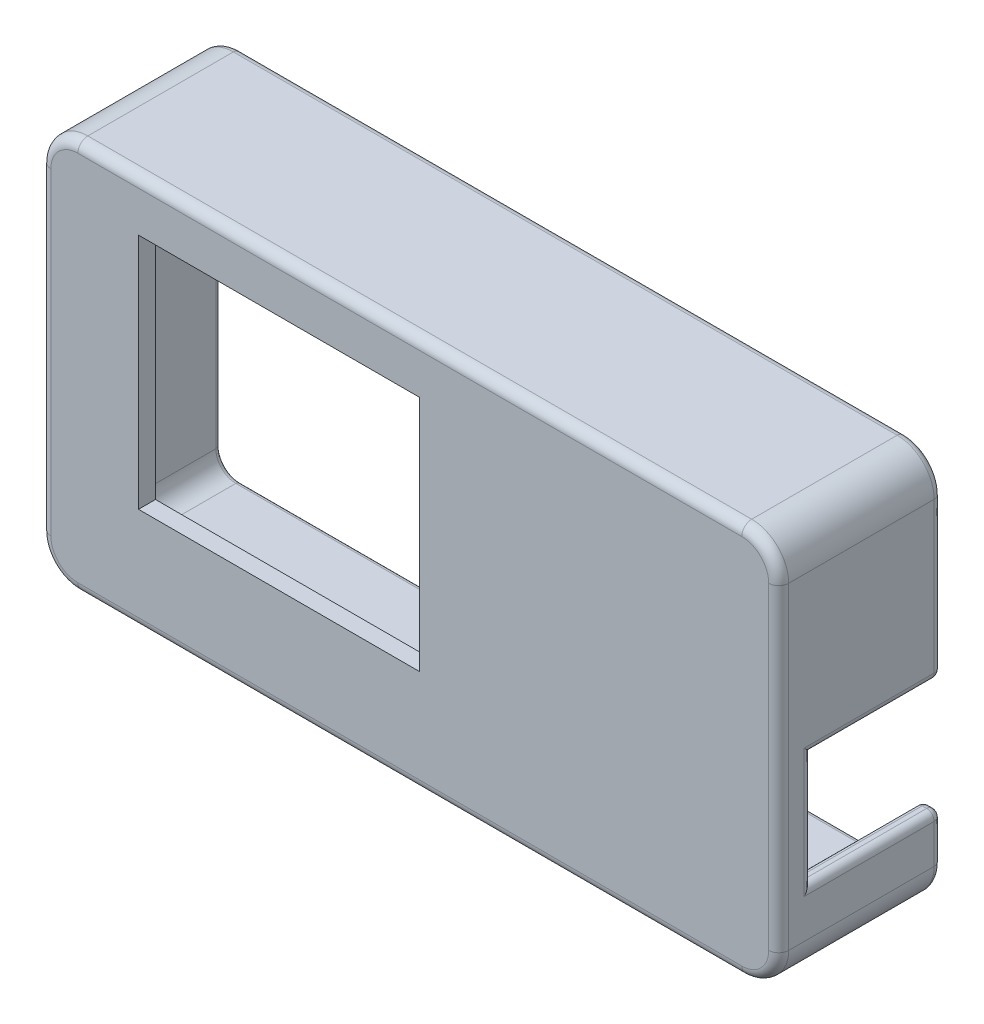
from build123d import *

# Parameters (mm, degrees)
BOSS_EXTRU_1_DEPTH      = 14.6
COQUE1_T                = 1.7
ESQUISSE7_W             = 1.7
ESQUISSE7_H             = 11.355170452
ENL_V_MAT_EXTRU_2_DEPTH = 13
CONG_2_R                = 0.75
ESQUISSE9_W             = 28.120859144
ESQUISSE9_H             = 23.752570345
ENL_V_MAT_EXTRU_3_DEPTH = 3
CONG_4_R                = 1
CONG_5_R                = 0.75
CONG_6_R                = 0.5


with BuildPart() as part:
    # Esquisse1 → Boss.-Extru.1 (new body)
    with BuildSketch(Plane.XY):
        with BuildLine():
            Line((2, 0), (68.4, 0))
            ThreePointArc((68.4, 0), (69.814213562, 0.585786438), (70.4, 2))
            Line((70.4, 2), (70.4, 33.8))
            ThreePointArc((70.4, 33.8), (69.814213562, 35.214213562), (68.4, 35.8))
            Line((68.4, 35.8), (2, 35.8))
            ThreePointArc((2, 35.8), (0.585786438, 35.214213562), (0, 33.8))
            Line((0, 33.8), (0, 2))
            ThreePointArc((0, 2), (0.585786438, 0.585786438), (2, 0))
        make_face()
    extrude(amount=BOSS_EXTRU_1_DEPTH)

    # Coque1
    coque1_openings = [part.faces().sort_by_distance(p)[0] for p in [
        (35.2, 17.9, 0),
    ]]
    offset(amount=COQUE1_T, openings=coque1_openings, kind=Kind.INTERSECTION)

    # Esquisse7 → Enlèv. mat.-Extru.2 (cut)
    with BuildSketch(Plane(origin=(0, 0, 0), x_dir=(-1, 0, 0), z_dir=(0, 0, -1))):
        with Locations((-71.25, 12.322414774)):
            Rectangle(ESQUISSE7_W, ESQUISSE7_H)
    extrude(amount=-ENL_V_MAT_EXTRU_2_DEPTH, mode=Mode.SUBTRACT)

    # Congé2
    cong_2_edges = [part.edges().sort_by_distance(p)[0] for p in [
        (71.25, 6.644829548, 0),
        (71.25, 18, 0),
    ]]
    fillet(cong_2_edges, radius=CONG_2_R)

    # Esquisse9 → Enlèv. mat.-Extru.3 (cut)
    with BuildSketch(Plane.XY.offset(16.3)):
        with Locations((22.126551481, 20.566590434)):
            Rectangle(ESQUISSE9_W, ESQUISSE9_H)
    extrude(amount=-ENL_V_MAT_EXTRU_3_DEPTH, mode=Mode.SUBTRACT)

    # Congé4
    cong_4_edges = [part.edges().sort_by_distance(p)[0] for p in [
        (-0.61629509, -0.61629509, 16.3),
        (35.2, -1.7, 16.3),
        (71.01629509, -0.61629509, 16.3),
        (72.1, 17.9, 16.3),
        (71.01629509, 36.41629509, 16.3),
        (35.2, 37.5, 16.3),
        (-0.61629509, 36.41629509, 16.3),
        (-1.7, 17.9, 16.3),
    ]]
    fillet(cong_4_edges, radius=CONG_4_R)

    # Congé5
    cong_5_edges = [part.edges().sort_by_distance(p)[0] for p in [
        (-1.7, 17.9, 0),
        (-0.61629509, 36.41629509, 0),
        (72.1, 12.322414774, 13),
        (72.1, 6.644829548, 6.875),
        (72.1, 18, 6.875),
        (72.1, 26.275, 0),
        (72.1, 18.219669914, 0.219669914),
        (72.1, 6.425159634, 0.219669914),
        (35.2, 37.5, 0),
        (71.01629509, 36.41629509, 0),
        (72.1, 3.947414774, 0),
        (71.01629509, -0.61629509, 0),
        (35.2, -1.7, 0),
        (-0.61629509, -0.61629509, 0),
    ]]
    fillet(cong_5_edges, radius=CONG_5_R)

    # Congé6
    cong_6_edges = [part.edges().sort_by_distance(p)[0] for p in [
        (0.585786438, 35.214213562, 0),
        (0, 17.9, 0),
        (0.585786438, 0.585786438, 0),
        (35.2, 0, 0),
        (69.814213562, 0.585786438, 0),
        (70.4, 3.947414774, 0),
        (69.814213562, 35.214213562, 0),
        (35.2, 35.8, 0),
        (70.4, 18, 6.875),
        (70.4, 6.644829548, 6.875),
        (70.4, 26.275, 0),
        (70.4, 18.219669914, 0.219669914),
        (70.4, 6.425159634, 0.219669914),
    ]]
    fillet(cong_6_edges, radius=CONG_6_R)


solid = part.part
